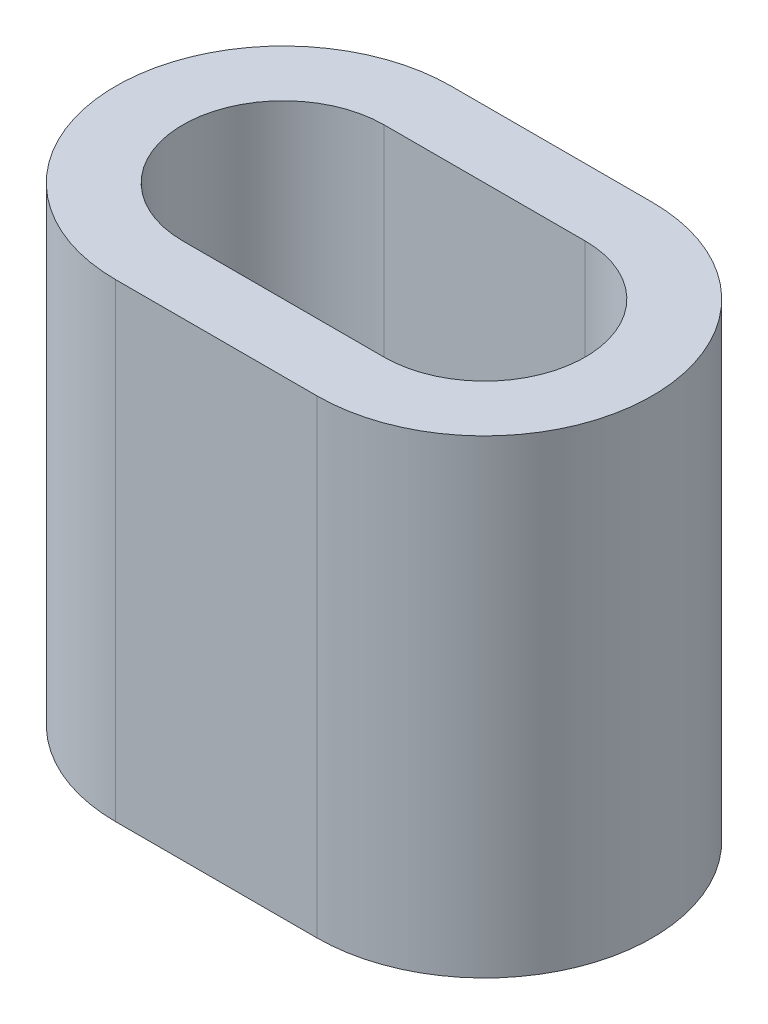
from build123d import *

# Parameters (mm, degrees)
BOSS_EXTRUDE1_DEPTH = 3.5


with BuildPart() as part:
    # Sketch1 → Boss-Extrude1 (new, symmetric)
    with BuildSketch(Plane(origin=(0, 0, 0), x_dir=(1, 0, 0), z_dir=(0, 1, 0))):
        with BuildLine():
            Line((1.5, -2.5), (-1.5, -2.5))
            ThreePointArc((-1.5, -2.5), (-4, 0), (-1.5, 2.5))
            Line((-1.5, 2.5), (1.5, 2.5))
            ThreePointArc((1.5, 2.5), (4, 0), (1.5, -2.5))
        make_face()
        with BuildLine():
            Line((1.5, -1.5), (-1.5, -1.5))
            ThreePointArc((-1.5, -1.5), (-3, 0), (-1.5, 1.5))
            Line((-1.5, 1.5), (1.5, 1.5))
            ThreePointArc((1.5, 1.5), (3, 0), (1.5, -1.5))
        make_face(mode=Mode.SUBTRACT)
    extrude(amount=BOSS_EXTRUDE1_DEPTH, both=True)


solid = part.part
